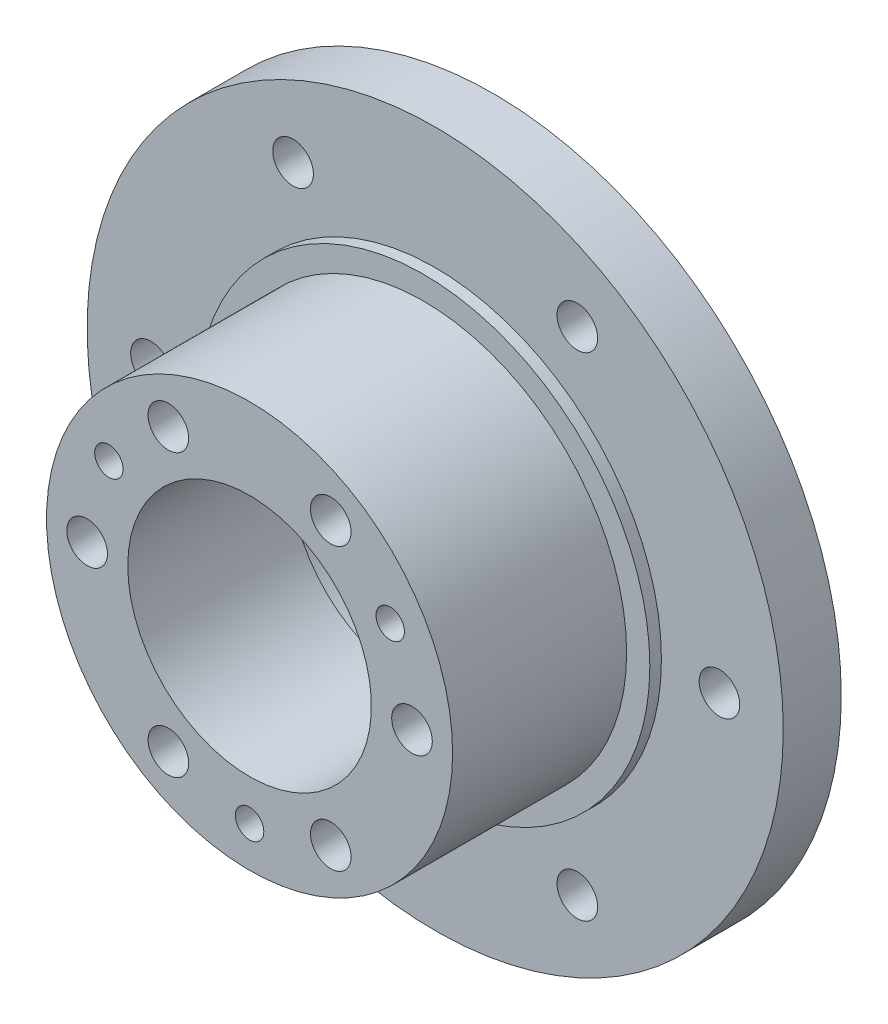
from build123d import *

# Parameters (mm, degrees)
SKETCH1_R           = 30
BOSS_EXTRUDE1_DEPTH = 5
SKETCH2_R           = 19.5
BOSS_EXTRUDE2_DEPTH = 1
SKETCH3_R           = 17.5
BOSS_EXTRUDE3_DEPTH = 15
SKETCH4_R           = 12.025
CUT_EXTRUDE1_DEPTH  = 7
SKETCH5_R           = 10.5
CUT_EXTRUDE2_DEPTH  = 45.676615807
SKETCH6_R           = 1.75
CUT_EXTRUDE3_DEPTH  = 46.343136195
SKETCH7_R           = 1.75
CUT_EXTRUDE4_DEPTH  = 10
SKETCH8_R           = 1.225
CUT_EXTRUDE5_DEPTH  = 12


with BuildPart() as part:
    # Sketch1 → Boss-Extrude1 (new body)
    with BuildSketch(Plane.XY):
        Circle(SKETCH1_R)
    extrude(amount=BOSS_EXTRUDE1_DEPTH)

    # Sketch2 → Boss-Extrude2 (add)
    with BuildSketch(Plane.XY.offset(5)):
        Circle(SKETCH2_R)
    extrude(amount=BOSS_EXTRUDE2_DEPTH)

    # Sketch3 → Boss-Extrude3 (add)
    with BuildSketch(Plane.XY.offset(6)):
        Circle(SKETCH3_R)
    extrude(amount=BOSS_EXTRUDE3_DEPTH)

    # Sketch4 → Cut-Extrude1 (cut)
    with BuildSketch(Plane(origin=(0, 0, 0), x_dir=(-1, 0, 0), z_dir=(0, 0, -1))):
        Circle(SKETCH4_R)
    extrude(amount=-CUT_EXTRUDE1_DEPTH, mode=Mode.SUBTRACT)

    # Sketch5 → Cut-Extrude2 (cut, through all)
    with BuildSketch(Plane(origin=(0, 0, 7), x_dir=(-1, 0, 0), z_dir=(0, 0, -1))):
        Circle(SKETCH5_R)
    extrude(amount=-CUT_EXTRUDE2_DEPTH, mode=Mode.SUBTRACT)

    # Sketch6 → Cut-Extrude3 (cut, through all)
    with BuildSketch(Plane.XY.offset(5)):
        with Locations((24.5, 0)):
            Circle(SKETCH6_R)
        with Locations((12.25, -21.217622393)):
            Circle(SKETCH6_R)
        with Locations((-12.25, -21.217622393)):
            Circle(SKETCH6_R)
        with Locations((-24.5, 0)):
            Circle(SKETCH6_R)
        with Locations((-12.25, 21.217622393)):
            Circle(SKETCH6_R)
        with Locations((12.25, 21.217622393)):
            Circle(SKETCH6_R)
    extrude(amount=-CUT_EXTRUDE3_DEPTH, mode=Mode.SUBTRACT)

    # Sketch7 → Cut-Extrude4 (cut)
    with BuildSketch(Plane.XY.offset(21)):
        with Locations((14, 0)):
            Circle(SKETCH7_R)
        with Locations((7, -12.124355653)):
            Circle(SKETCH7_R)
        with Locations((-7, -12.124355653)):
            Circle(SKETCH7_R)
        with Locations((-14, 0)):
            Circle(SKETCH7_R)
        with Locations((-7, 12.124355653)):
            Circle(SKETCH7_R)
        with Locations((7, 12.124355653)):
            Circle(SKETCH7_R)
    extrude(amount=-CUT_EXTRUDE4_DEPTH, mode=Mode.SUBTRACT)

    # Sketch8 → Cut-Extrude5 (cut)
    with BuildSketch(Plane.XY.offset(21)):
        with Locations((12.124355653, 7)):
            Circle(SKETCH8_R)
        with Locations((0, -14)):
            Circle(SKETCH8_R)
        with Locations((-12.124355653, 7)):
            Circle(SKETCH8_R)
    extrude(amount=-CUT_EXTRUDE5_DEPTH, mode=Mode.SUBTRACT)


solid = part.part
